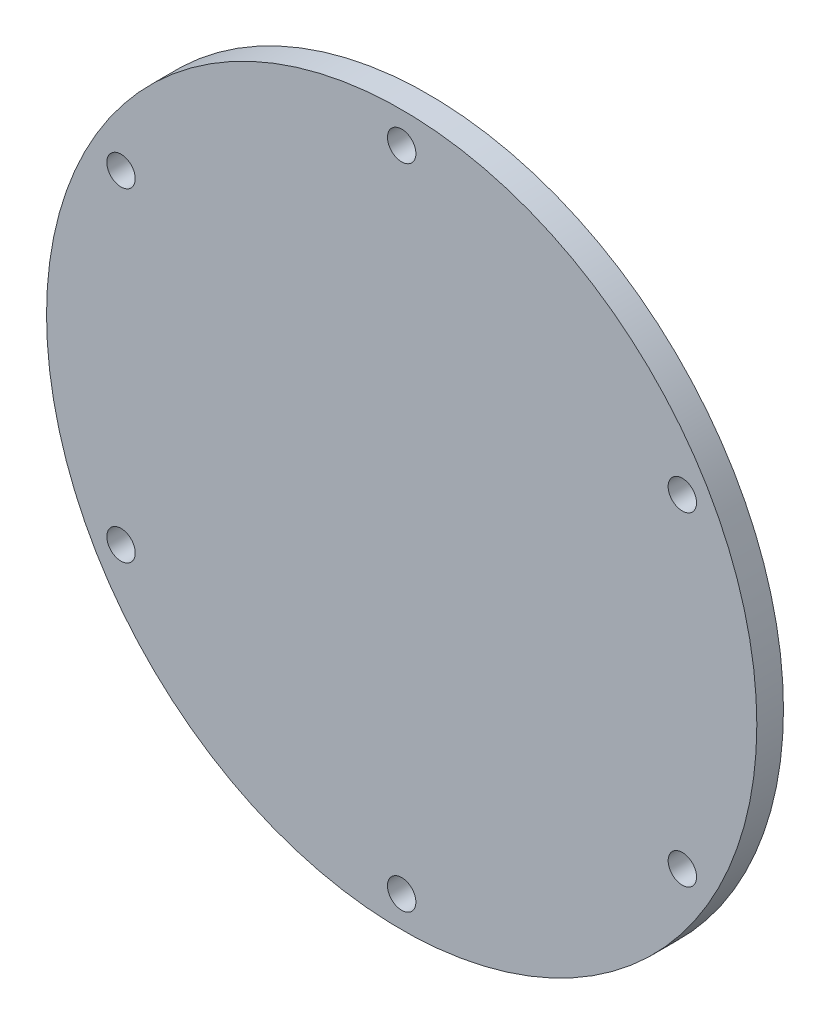
from build123d import *

# Parameters (mm, degrees)
SKETCH1_R           = 40
SKETCH1_R_2         = 1.6
BOSS_EXTRUDE1_DEPTH = 3


with BuildPart() as part:
    # Sketch1 → Boss-Extrude1 (new body)
    with BuildSketch(Plane.XY):
        Circle(SKETCH1_R)
        with Locations((31.609927238, -18.25)):
            Circle(SKETCH1_R_2, mode=Mode.SUBTRACT)
        with Locations((31.609927238, 18.25)):
            Circle(SKETCH1_R_2, mode=Mode.SUBTRACT)
        with Locations((0, 36.5)):
            Circle(SKETCH1_R_2, mode=Mode.SUBTRACT)
        with Locations((-31.609927238, 18.25)):
            Circle(SKETCH1_R_2, mode=Mode.SUBTRACT)
        with Locations((-31.609927238, -18.25)):
            Circle(SKETCH1_R_2, mode=Mode.SUBTRACT)
        with Locations((0, -36.5)):
            Circle(SKETCH1_R_2, mode=Mode.SUBTRACT)
    extrude(amount=BOSS_EXTRUDE1_DEPTH)


solid = part.part
